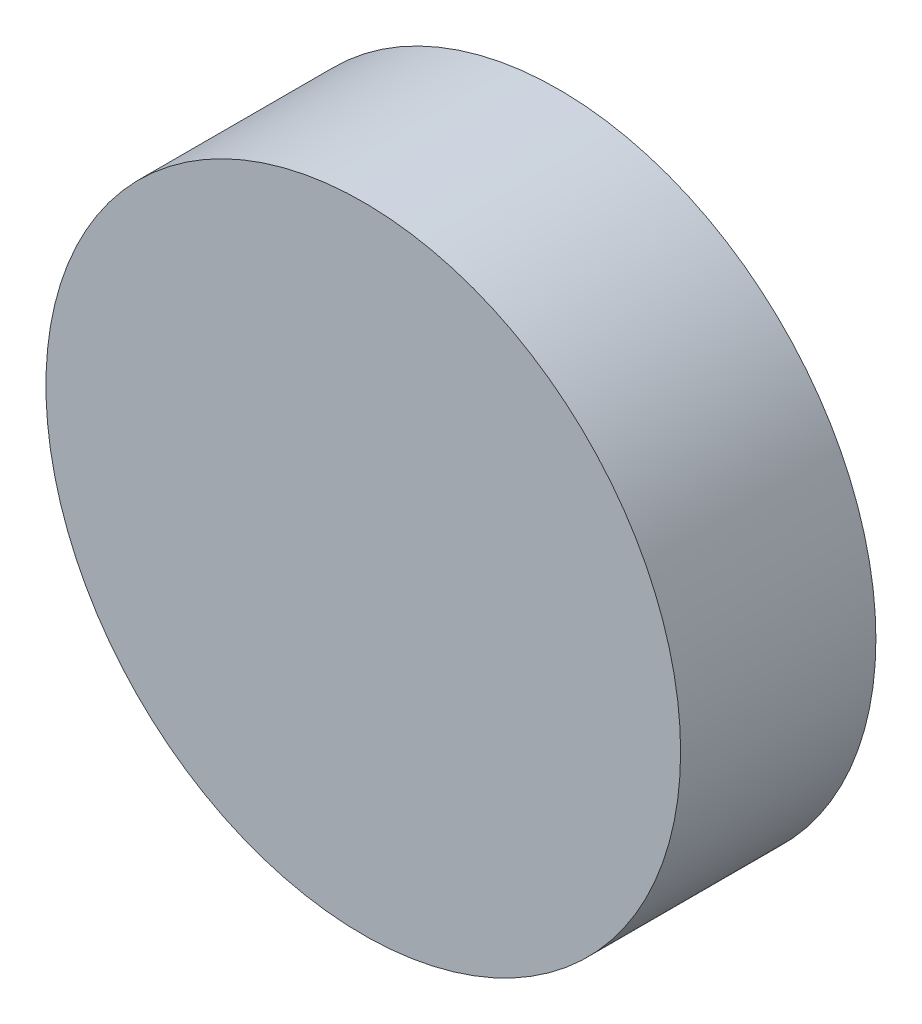
from build123d import *

# Parameters (mm, degrees)
SKETCH1_R           = 8.255
BOSS_EXTRUDE1_DEPTH = 5.08


with BuildPart() as part:
    # Sketch1 → Boss-Extrude1 (new body)
    with BuildSketch(Plane.XY):
        Circle(SKETCH1_R)
    extrude(amount=BOSS_EXTRUDE1_DEPTH)


solid = part.part
